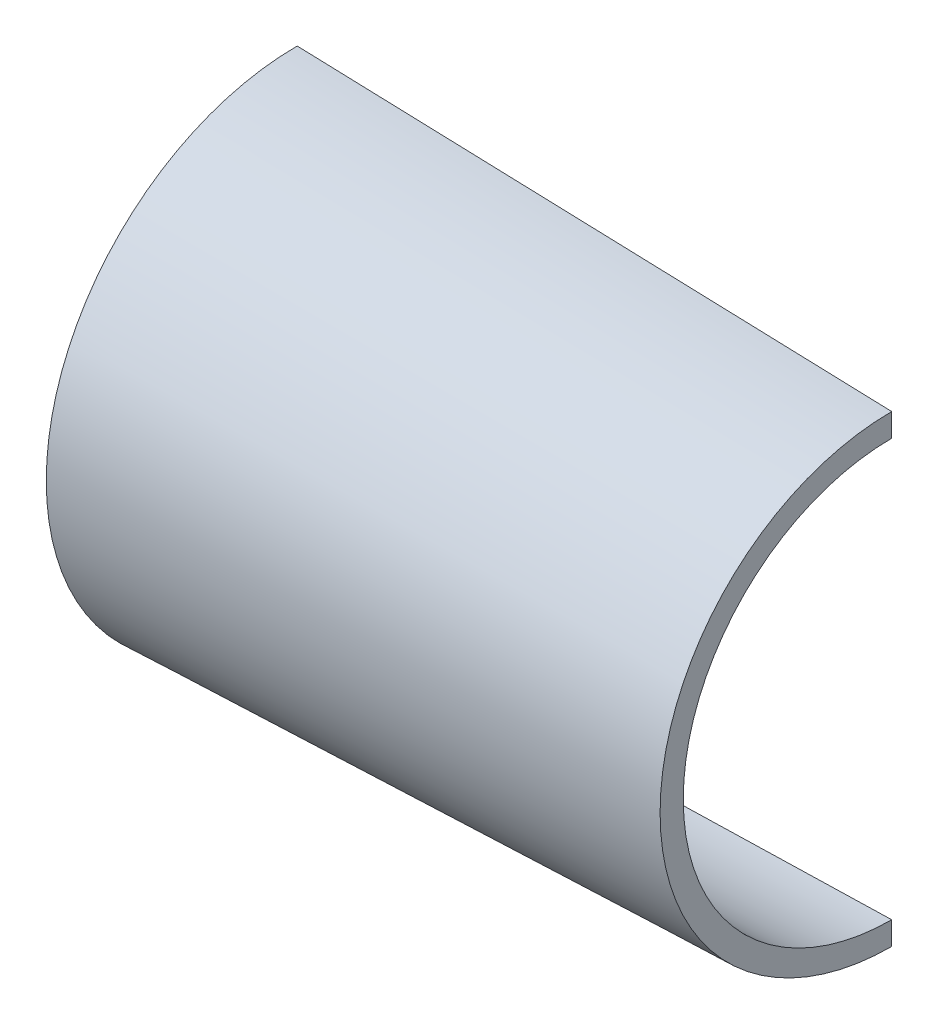
from build123d import *

# Parameters (mm, degrees)
REVOLVE1_ANGLE = 179.99999693


with BuildPart() as part:
    # Sketch1 → Revolve1 (revolve)
    with BuildSketch(Plane.XY):
        Polygon((1880, 580), (1880, 650), (3420, 600), (3420, 540), align=None)
    revolve(axis=Axis((0, 0, 0), (1, 0, 0)), revolution_arc=REVOLVE1_ANGLE)


solid = part.part
